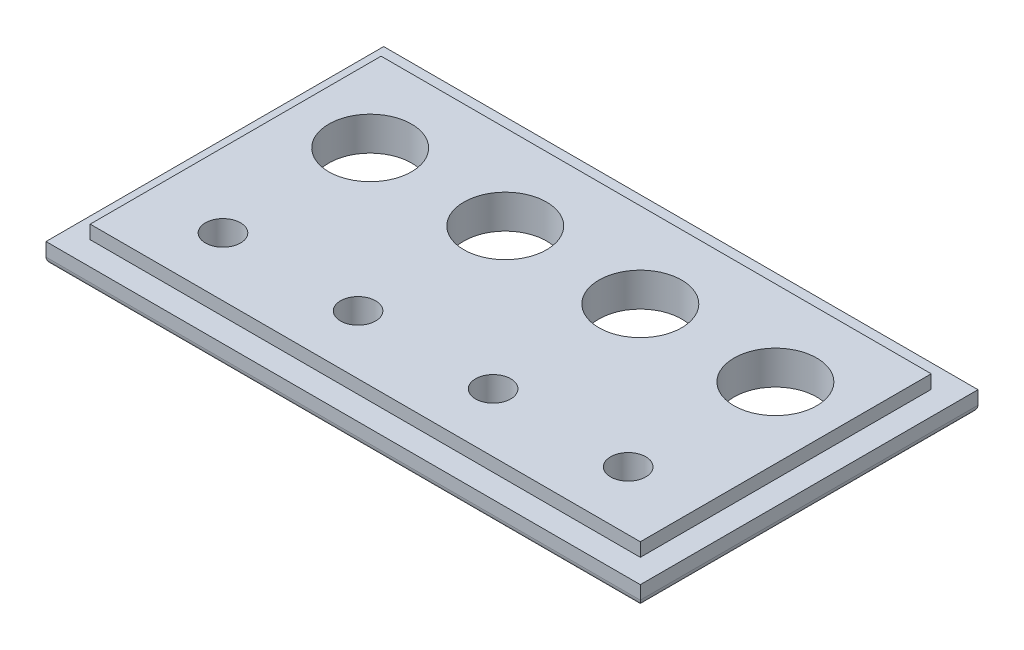
from build123d import *

# Parameters (mm, degrees)
SKETCH4_W               = 88
SKETCH4_H               = 50
BOSS_EXTRUDE2_DEPTH     = 3
SKETCH6_W               = 81.456613026
SKETCH6_H               = 43.073471677
BOSS_EXTRUDE3_DEPTH     = 2
CUT_EXTRUDE1_DEPTH      = 67.670833203
CUT_EXTRUDE1_DEPTH_BACK = 67.670833203
SKETCH5_R               = 6.125
SKETCH5_R_2             = 2.6
FILLET1_R               = 1


with BuildPart() as part:
    # Sketch4 → Boss-Extrude2 (new body)
    with BuildSketch(Plane(origin=(0, 0, 0), x_dir=(1, 0, 0), z_dir=(0, 1, 0))):
        with Locations((0, 25)):
            Rectangle(SKETCH4_W, SKETCH4_H)
    extrude(amount=BOSS_EXTRUDE2_DEPTH)

    # Sketch6 → Boss-Extrude3 (add)
    with BuildSketch(Plane(origin=(0, 3, 0), x_dir=(1, 0, 0), z_dir=(0, 1, 0))):
        with Locations((-0.228306513, 25.036735839)):
            Rectangle(SKETCH6_W, SKETCH6_H)
    extrude(amount=BOSS_EXTRUDE3_DEPTH)

    # Sketch5 → Cut-Extrude1 (cut, two sides: drawn at the far end of the back side and taken through both)
    with BuildSketch(Plane(origin=(0, 3, 0), x_dir=(-1, 0, 0), z_dir=(0, 1, 0)).offset(-CUT_EXTRUDE1_DEPTH_BACK)):
        with Locations(Location((-30, -34, 0), (0, 0, 90))):
            Circle(SKETCH5_R)
        with Locations(Location((-10, -34, 0), (0, 0, 90))):
            Circle(SKETCH5_R)
        with Locations(Location((10, -34, 0), (0, 0, 90))):
            Circle(SKETCH5_R)
        with Locations(Location((30, -34, 0), (0, 0, 90))):
            Circle(SKETCH5_R)
        with Locations(Location((-30, -12.206810763, 0), (0, 0, 90))):
            Circle(SKETCH5_R_2)
        with Locations(Location((-10, -12.206810763, 0), (0, 0, 90))):
            Circle(SKETCH5_R_2)
        with Locations(Location((10, -12.206810763, 0), (0, 0, 90))):
            Circle(SKETCH5_R_2)
        with Locations(Location((30, -12.206810763, 0), (0, 0, 90))):
            Circle(SKETCH5_R_2)
    extrude(amount=CUT_EXTRUDE1_DEPTH + CUT_EXTRUDE1_DEPTH_BACK, mode=Mode.SUBTRACT)

    # Fillet1
    fillet1_edges = [part.edges().sort_by_distance(p)[0] for p in [
        (0, 0, 0),
        (-44, 0, -25),
        (0, 0, -50),
        (44, 0, -25),
    ]]
    fillet(fillet1_edges, radius=FILLET1_R)


solid = part.part
